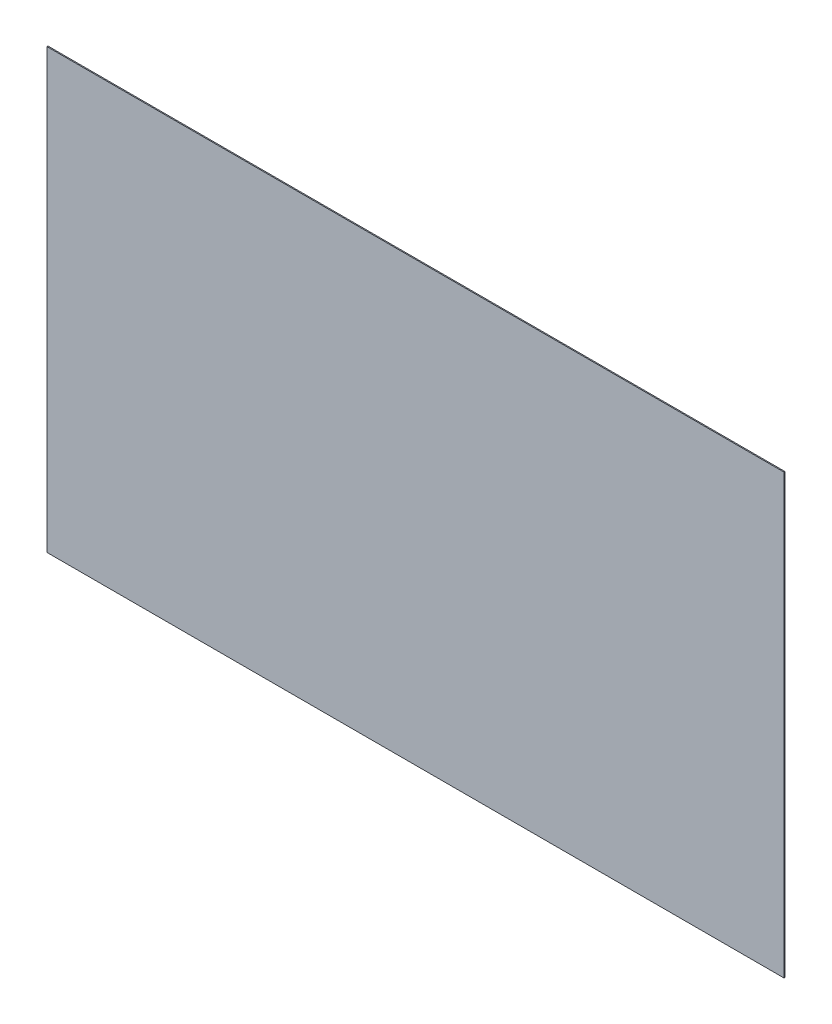
from build123d import *

# Parameters (mm, degrees)
SKETCH1_W      = 71.5
SKETCH1_H      = 42.5
EXTRUDE1_DEPTH = 0.1


with BuildPart() as part:
    # Sketch1 → Extrude1 (new body)
    with BuildSketch(Plane.XY):
        with Locations((3.25, -9.95)):
            Rectangle(SKETCH1_W, SKETCH1_H)
    extrude(amount=EXTRUDE1_DEPTH)


solid = part.part
